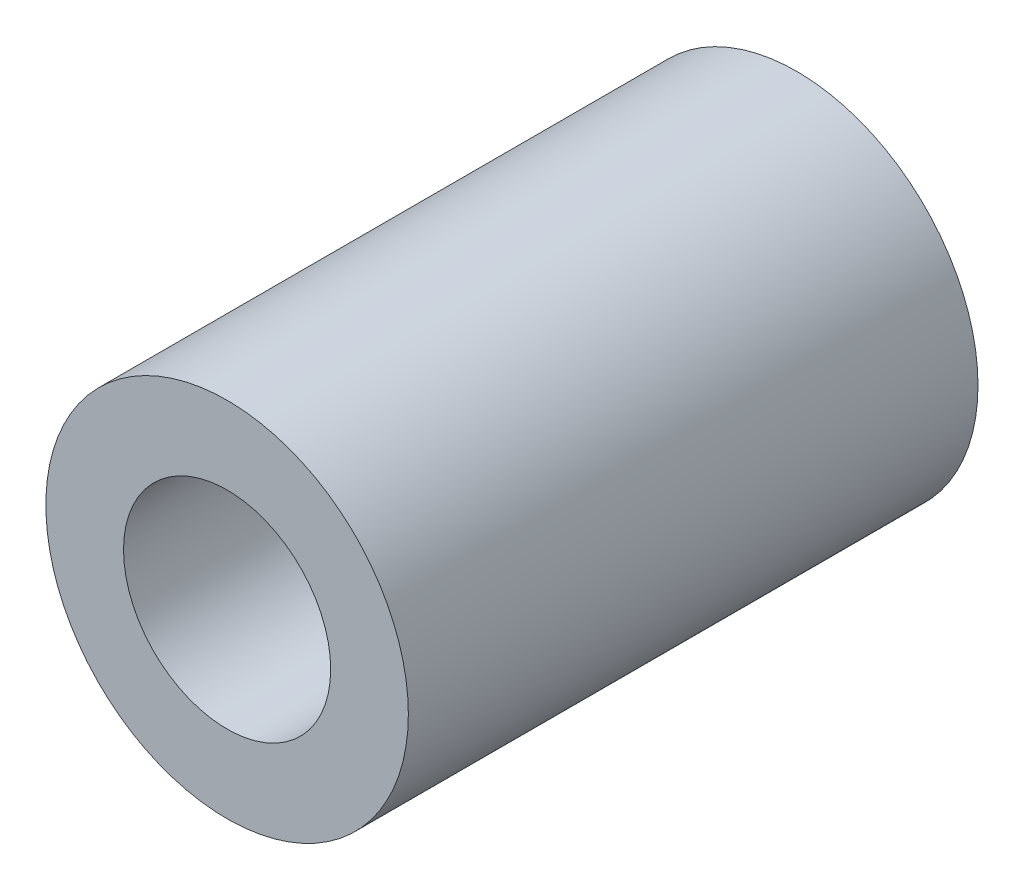
from build123d import *

# Parameters (mm, degrees)
SKETCH1_R           = 3.5
SKETCH1_R_2         = 2
BOSS_EXTRUDE1_DEPTH = 11


with BuildPart() as part:
    # Sketch1 → Boss-Extrude1 (new body)
    with BuildSketch(Plane.XY):
        Circle(SKETCH1_R)
        Circle(SKETCH1_R_2, mode=Mode.SUBTRACT)
    extrude(amount=BOSS_EXTRUDE1_DEPTH)


solid = part.part
